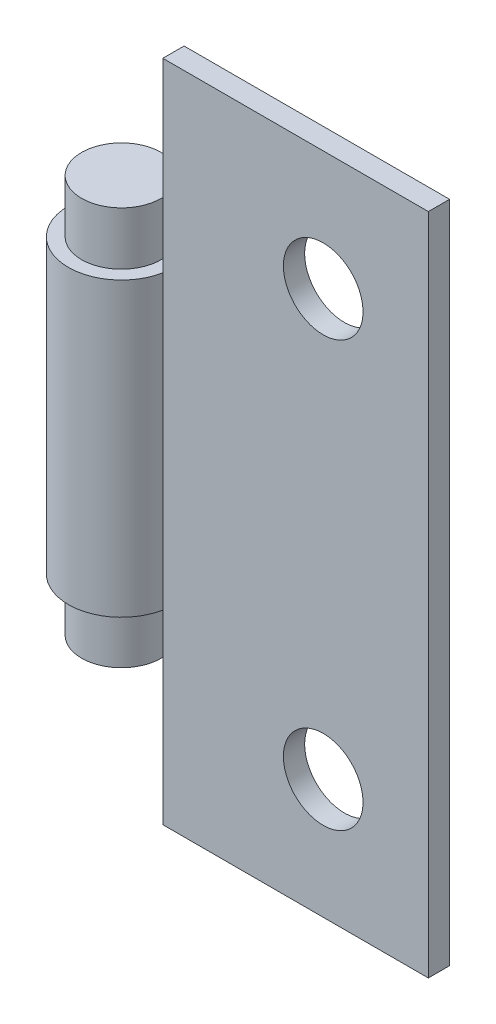
from build123d import *

# Parameters (mm, degrees)
SKETCH_1_W          = 10
SKETCH_1_H          = 25
EXTRUDE_1_DEPTH     = 0.8
SKETCH_4_R          = 2
EXTRUDE_2_DEPTH     = 5.5
SKETCH_5_R          = 1.5
EXTRUDE_3_DEPTH     = 2
SKETCH_6_R          = 1.5
CUT_EXTRUDE_1_DEPTH = 4


with BuildPart() as part:
    # 草图1 → 凸台-拉伸1 (new body)
    with BuildSketch(Plane.XY):
        Rectangle(SKETCH_1_W, SKETCH_1_H)
    extrude(amount=EXTRUDE_1_DEPTH)

    # 草图4 → 凸台-拉伸2 (add, symmetric)
    with BuildSketch(Plane(origin=(0, 0, 0), x_dir=(1, 0, 0), z_dir=(0, 1, 0))):
        with Locations((-6.959591794, -0.4)):
            Circle(SKETCH_4_R)
    extrude(amount=EXTRUDE_2_DEPTH, both=True)

    # 草图5 → 凸台-拉伸3 (add, symmetric)
    with BuildSketch(Plane(origin=(0, 5.5, 0), x_dir=(1, 0, 0), z_dir=(0, 1, 0))):
        with Locations(Location((-6.959591794, -0.4, 0), (0, 0, 270))):
            Circle(SKETCH_5_R)
    extrude_3 = extrude(amount=EXTRUDE_3_DEPTH, both=True)

    # 镜向1: 凸台-拉伸3 across plane
    add(extrude_3.mirror(Plane.ZX))

    # 草图6 → 切除-拉伸1 (cut)
    with BuildSketch(Plane(origin=(0, 0, 0), x_dir=(-1, 0, 0), z_dir=(0, 0, -1))):
        with Locations((-1.040408206, 8)):
            Circle(SKETCH_6_R)
        with Locations((-1.040408206, -8)):
            Circle(SKETCH_6_R)
    extrude(amount=-CUT_EXTRUDE_1_DEPTH, mode=Mode.SUBTRACT)


solid = part.part
